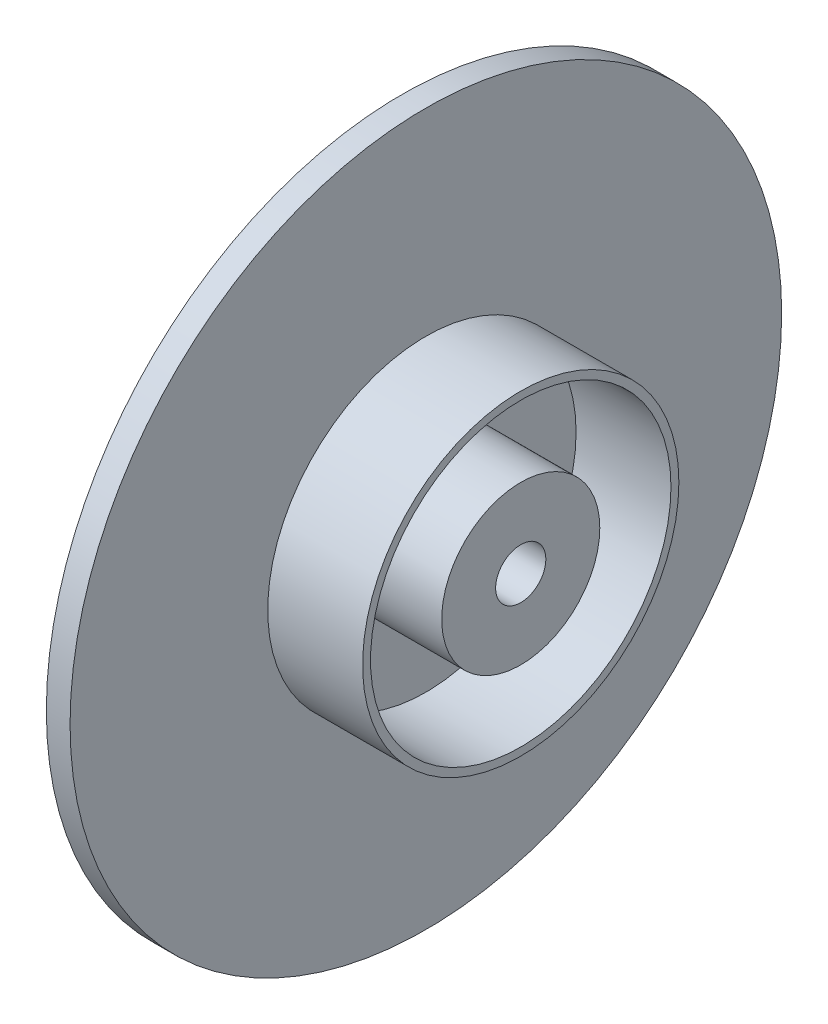
from build123d import *

# Parameters (mm, degrees)
SPROCKET_R                   = 45
ESTRUSIONE_ESTRUSIONE2_DEPTH = 3
SCHIZZO4_R                   = 10
ESTRUSIONE_ESTRUSIONE4_DEPTH = 12
SCHIZZO5_R                   = 20
SCHIZZO5_R_2                 = 19
ESTRUSIONE_ESTRUSIONE5_DEPTH = 12
SCHIZZO6_R                   = 3.175
TAGLIO_ESTRUSIONE1_DEPTH     = 66.383484153
SCALE1_SCALE                 = 0.6


with BuildPart() as part:
    # Sprocket → Estrusione-Estrusione2 (new body)
    with BuildSketch(Plane(origin=(0, 0, 0), x_dir=(0, 0, -1), z_dir=(1, 0, 0))):
        Circle(SPROCKET_R)
    extrude(amount=ESTRUSIONE_ESTRUSIONE2_DEPTH)

    # Schizzo4 → Estrusione-Estrusione4 (add)
    with BuildSketch(Plane(origin=(3, 0, 0), x_dir=(0, 0, -1), z_dir=(1, 0, 0))):
        Circle(SCHIZZO4_R)
    extrude(amount=ESTRUSIONE_ESTRUSIONE4_DEPTH)

    # Schizzo5 → Estrusione-Estrusione5 (add)
    with BuildSketch(Plane(origin=(3, 0, 0), x_dir=(0, 0, -1), z_dir=(1, 0, 0))):
        Circle(SCHIZZO5_R)
        Circle(SCHIZZO5_R_2, mode=Mode.SUBTRACT)
    extrude(amount=ESTRUSIONE_ESTRUSIONE5_DEPTH)

    # Schizzo6 → Taglio-Estrusione1 (cut, through all)
    with BuildSketch(Plane(origin=(15, 0, 0), x_dir=(0, 0, -1), z_dir=(1, 0, 0))):
        Circle(SCHIZZO6_R)
    extrude(amount=-TAGLIO_ESTRUSIONE1_DEPTH, mode=Mode.SUBTRACT)


with BuildPart() as part_1:
    # Scale1: scaled about (3.02832768, 0, 0)
    add(part.part.scale(SCALE1_SCALE).moved(Location((1.211331072, 0, 0))))


solid = part_1.part
